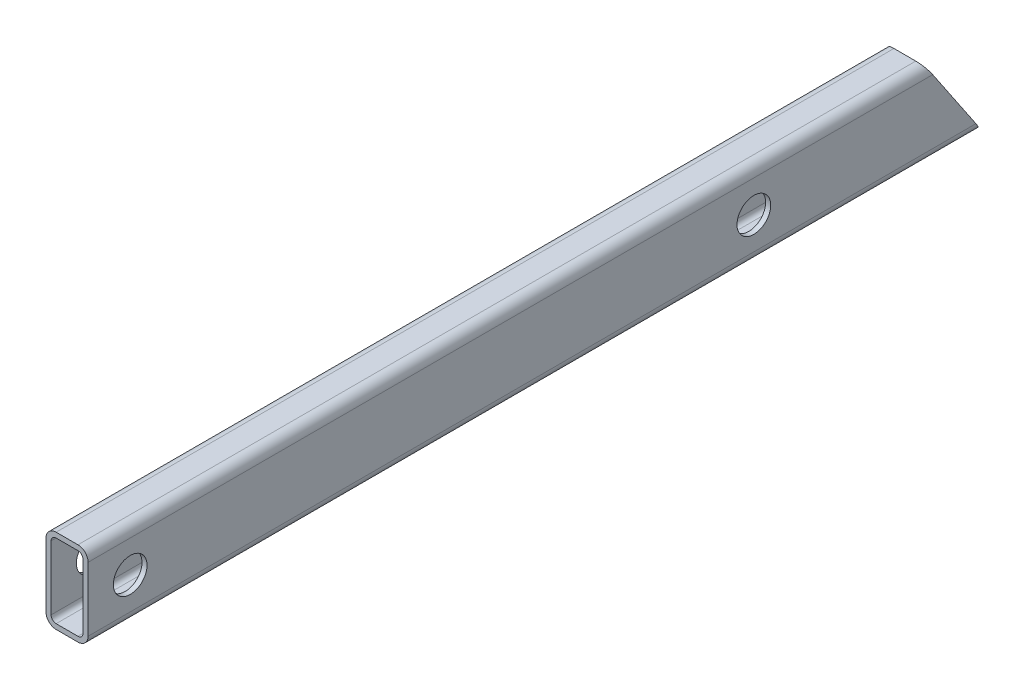
from build123d import *

# Parameters (mm, degrees)
BOSS_EXTRUDE1_DEPTH = 530.8
SKETCH2_R           = 10
CUT_EXTRUDE1_DEPTH  = 534.733736359
CUT_EXTRUDE2_DEPTH  = 534.733736359


with BuildPart() as part:
    # Sketch1 → Boss-Extrude1 (new body)
    with BuildSketch(Plane.XY):
        with BuildLine():
            Line((0, 44), (0, 6))
            ThreePointArc((0, 6), (1.757359313, 1.757359313), (6, 0))
            Line((6, 0), (18.96119643, 0))
            ThreePointArc((18.96119643, 0), (23.203837117, 1.757359313), (24.96119643, 6))
            Line((24.96119643, 6), (24.96119643, 44))
            ThreePointArc((24.96119643, 44), (23.203837117, 48.242640687), (18.96119643, 50))
            Line((18.96119643, 50), (6, 50))
            ThreePointArc((6, 50), (1.757359313, 48.242640687), (0, 44))
        make_face()
        with BuildLine():
            Line((3, 44), (3, 6))
            ThreePointArc((3, 6), (3.878679656, 3.878679656), (6, 3))
            Line((6, 3), (18.96119643, 3))
            ThreePointArc((18.96119643, 3), (21.082516774, 3.878679656), (21.96119643, 6))
            Line((21.96119643, 6), (21.96119643, 44))
            ThreePointArc((21.96119643, 44), (21.082516774, 46.121320344), (18.96119643, 47))
            Line((18.96119643, 47), (6, 47))
            ThreePointArc((6, 47), (3.878679656, 46.121320344), (3, 44))
        make_face(mode=Mode.SUBTRACT)
    extrude(amount=BOSS_EXTRUDE1_DEPTH)

    # Sketch2 → Cut-Extrude1 (cut, through all)
    with BuildSketch(Plane(origin=(24.96119643, 0, 0), x_dir=(0, 0, -1), z_dir=(1, 0, 0))):
        with Locations((-505.8, 25)):
            Circle(SKETCH2_R)
        Polygon((0, 0), (0, 50), (-33.73, 50), align=None)
    extrude(amount=-CUT_EXTRUDE1_DEPTH, mode=Mode.SUBTRACT)

    # Sketch2<6> → Cut-Extrude2 (cut, through all)
    with BuildSketch(Plane(origin=(24.96119643, 0, 0), x_dir=(0, 0, -1), z_dir=(1, 0, 0))):
        with BuildLine():
            ThreePointArc((-125.8, 25), (-135.8, 35), (-145.8, 25))
            ThreePointArc((-145.8, 25), (-135.8, 15), (-125.8, 25))
        make_face()
    extrude(amount=-CUT_EXTRUDE2_DEPTH, mode=Mode.SUBTRACT)


solid = part.part
